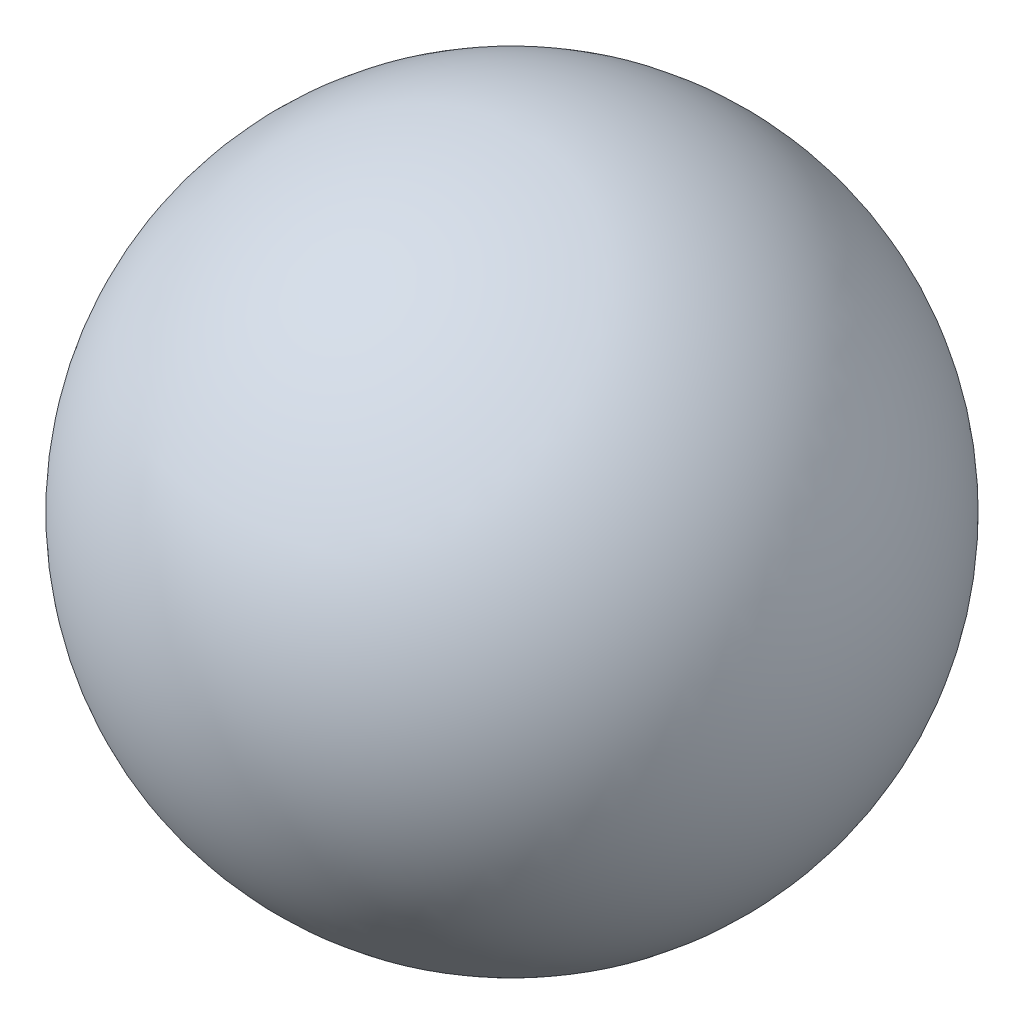
from build123d import *


with BuildPart() as part:
    # Sketch1 → Revolve1 (revolve)
    with BuildSketch(Plane.XY):
        with BuildLine():
            Line((0, -88.9), (0, 88.9))
            ThreePointArc((0, 88.9), (88.9, 0), (0, -88.9))
        make_face()
    revolve(axis=Axis((0, -88.9, 0), (0, 1, 0)))


solid = part.part
